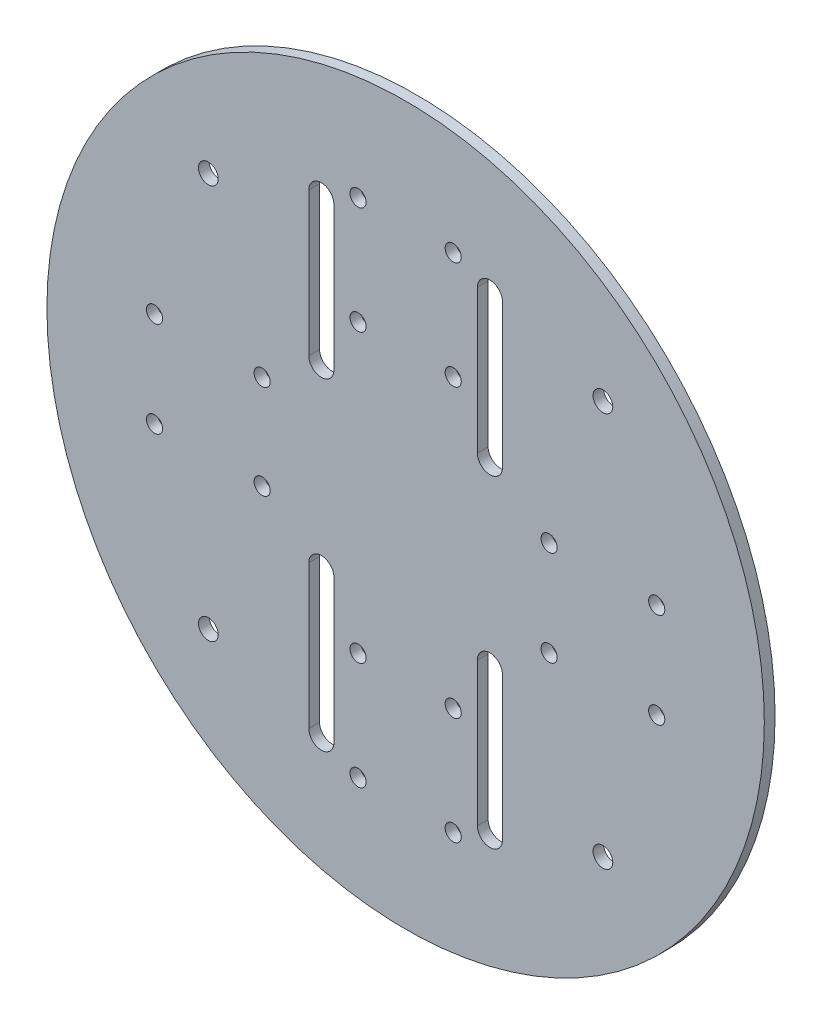
from build123d import *

# Parameters (mm, degrees)
IZIM1_R                     = 100
Y_KSEKLIK_EKSTR_ZYON1_DEPTH = 30
KES_EKSTR_ZYON1_DEPTH       = 145.568322948
M5_BO_LUKLU_DELIK2_D        = 5.5
IZIM20_R                    = 183.537558205
KES_EKSTR_ZYON2_DEPTH       = 27
M4_BO_LUKLU_DELIK1_D        = 4.5
M4_BO_LUKLU_DELIK2_D        = 4.5


with BuildPart() as part:
    # Çizim1 → Yükseklik-Ekstrüzyon1 (new body)
    with BuildSketch(Plane.XY):
        Circle(IZIM1_R)
    extrude(amount=Y_KSEKLIK_EKSTR_ZYON1_DEPTH)

    # Çizim9 → Kes-Ekstrüzyon1 (cut, through all)
    with BuildSketch(Plane.XY.offset(30)):
        with BuildLine():
            Line((27, 65), (27, 25))
            ThreePointArc((27, 25), (23.5, 21.5), (20, 25))
            Line((20, 25), (20, 65))
            ThreePointArc((20, 65), (23.5, 68.5), (27, 65))
        make_face()
        with BuildLine():
            Line((-20, 65), (-20, 25))
            ThreePointArc((-20, 25), (-23.5, 21.5), (-27, 25))
            Line((-27, 25), (-27, 65))
            ThreePointArc((-27, 65), (-23.5, 68.5), (-20, 65))
        make_face()
        with BuildLine():
            Line((-20, -25), (-20, -65))
            ThreePointArc((-20, -65), (-23.5, -68.5), (-27, -65))
            Line((-27, -65), (-27, -25))
            ThreePointArc((-27, -25), (-23.5, -21.5), (-20, -25))
        make_face()
        with BuildLine():
            Line((20, -65), (20, -25))
            ThreePointArc((20, -25), (23.5, -21.5), (27, -25))
            Line((27, -25), (27, -65))
            ThreePointArc((27, -65), (23.5, -68.5), (20, -65))
        make_face()
    extrude(amount=-KES_EKSTR_ZYON1_DEPTH, mode=Mode.SUBTRACT)

    # M5 Boşluklu Delik2 (through all)
    with Locations(Plane.XY.offset(30)):
        with Locations((-55, 55), (55, 55), (55, -55), (-55, -55)):
            Hole(M5_BO_LUKLU_DELIK2_D / 2)

    # Çizim20 → Kes-Ekstrüzyon2 (cut)
    with BuildSketch(Plane.XY.offset(30)):
        with Locations((0, 8.479468632)):
            Circle(IZIM20_R)
    extrude(amount=-KES_EKSTR_ZYON2_DEPTH, mode=Mode.SUBTRACT)

    # M4 Boşluklu Delik1 (through all)
    with Locations(Plane.XY.offset(3)):
        with Locations((-13.265, 40), (-13.265, 70), (13.265, 70), (13.265, 40)):
            Hole(M4_BO_LUKLU_DELIK1_D / 2)

    # M4 Boşluklu Delik2 (through all)
    with Locations(Plane.XY.offset(3)):
        with Locations((40, 13.265), (70, 13.265), (70, -13.265), (40, -13.265), (-40, -12.99677614), (-40, 13.265), (-70, 13.53322386), (-70, -12.99677614), (-13.265, -40), (13.265, -40), (13.265, -70), (-13.265, -70)):
            Hole(M4_BO_LUKLU_DELIK2_D / 2)


solid = part.part
